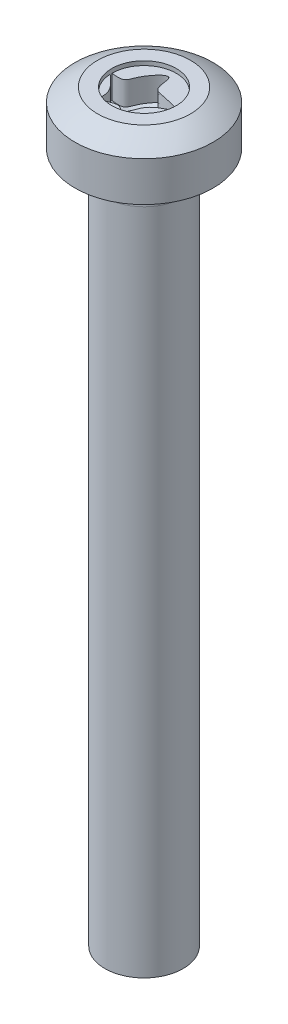
from build123d import *

# Parameters (mm, degrees)
RECESS_CUT_EXTRUDE1_DEPTH = 2.42
SKETCH7_R                 = 2.8
RECESS_CUT_EXTRUDE2_DEPTH = 0.363


with BuildPart() as part:
    # Sketch1 → BODY (revolve)
    with BuildSketch(Plane.XY, mode=Mode.PRIVATE) as body_sk:
        Polygon((0, 0), (3.4, 0), (3.4, 60), (6, 60), (6, 64.6), (0, 64.6), align=None)
    revolve(body_sk.sketch.rotate(Axis((0, 0, 0), (0, 1, 0)), 90), axis=Axis((0, 0, 0), (0, 1, 0)))

    # Sketch2 → HEAD-CUT (revolve, cut)
    with BuildSketch(Plane.XY, mode=Mode.PRIVATE) as head_cut_sk:
        with BuildLine():
            ThreePointArc((10, 55.45), (7.071067812, 62.521067812), (0, 65.45))
            Line((0, 65.45), (0, 65.93216157))
            Line((0, 65.93216157), (10, 65.93216157))
            Line((10, 65.93216157), (10, 55.45))
        make_face()
    revolve(head_cut_sk.sketch.rotate(Axis((0, 0, 0), (0, 1, 0)), 90), axis=Axis((0, 0, 0), (0, 1, 0)), mode=Mode.SUBTRACT)

    # Sketch4 → GAP (revolve, cut)
    with BuildSketch(Plane.XY, mode=Mode.PRIVATE) as gap_sk:
        with BuildLine():
            Line((-3.4, 58), (-3.251503787, 59.75))
            ThreePointArc((-3.251503787, 59.75), (-3.28566705, 59.89880979), (-3.4, 60))
            Line((-3.4, 60), (-3.4, 58))
        make_face()
    revolve(gap_sk.sketch.rotate(Axis((0, 0, 0), (0, 1, 0)), 270), axis=Axis((0, 0, 0), (0, 1, 0)), mode=Mode.SUBTRACT)

    # Sketch5 → Recess-Cut-Extrude1 (cut)
    with BuildSketch(Plane(origin=(0, 64.6, 0), x_dir=(-1, 0, 0), z_dir=(0, 1, 0))):
        with BuildLine():
            add(Edge.make_bspline(
                [(2.8, 0), (2.645109866, -0.023911085), (1.670994331, 0.199786237), (1.414118172, -1.106473263), (-0.315407204, -3.117616193), (-0.08378741, -0.750252113), (-1.3658447, -0.443842911), (-2.797125263, -0.196308398), (-2.80002409, 0.001077292), (-2.800023768, 0.001616003)],
                knots=[0.179018134, 0.179018134, 0.179018134, 0.179018134, 0.237467971, 0.292040128, 0.415648105, 0.507114761, 0.541693416, 0.662364746, 0.662694958, 0.662694958, 0.662694958, 0.662694958], degree=3))
            ThreePointArc((2.8, 0), (2.799094521, 0.071202971), (2.796378669, 0.142359889))
            add(Edge.make_bspline(
                [(1.4, 2.424871131), (1.513938157, 2.323513219), (1.329282824, 1.267778391), (2.57149917, 0.398112713), (2.796378669, 0.142359889)],
                knots=[0, 0, 0, 0, 0.052176783, 0.148749777, 0.148749777, 0.148749777, 0.148749777], degree=3))
            ThreePointArc((1.4, 2.424871131), (1.379598676, 2.436535962), (1.359100168, 2.448029153))
            add(Edge.make_bspline(
                [(-2.800023768, 0.001616003), (-2.799909028, 0.193193204), (-0.88460249, 0.55646964), (-0.772921937, 2.873205542), (0.205731927, 1.792311947), (1.119461988, 2.526850423), (1.359100168, 2.448029153)],
                knots=[0.662694958, 0.662694958, 0.662694958, 0.662694958, 0.780125533, 0.878673095, 0.910848295, 0.994606061, 0.994606061, 0.994606061, 0.994606061], degree=3))
        make_face()
    extrude(amount=-RECESS_CUT_EXTRUDE1_DEPTH, mode=Mode.SUBTRACT)

    # Sketch3 → DRILL-CUT (revolve, cut)
    with BuildSketch(Plane.XY):
        Polygon((0, 60.936476343), (2.153846154, 62.18), (0, 62.18), align=None)
    revolve(axis=Axis((0, 0, 0), (0, 1, 0)), mode=Mode.SUBTRACT)

    # Sketch7 → Recess-Cut-Extrude2 (cut)
    with BuildSketch(Plane(origin=(0, 64.6, 0), x_dir=(-1, 0, 0), z_dir=(0, 1, 0))):
        with Locations(Location((0, 0, 0), (0, 0, 90))):
            Circle(SKETCH7_R)
    extrude(amount=-RECESS_CUT_EXTRUDE2_DEPTH, mode=Mode.SUBTRACT)


solid = part.part
